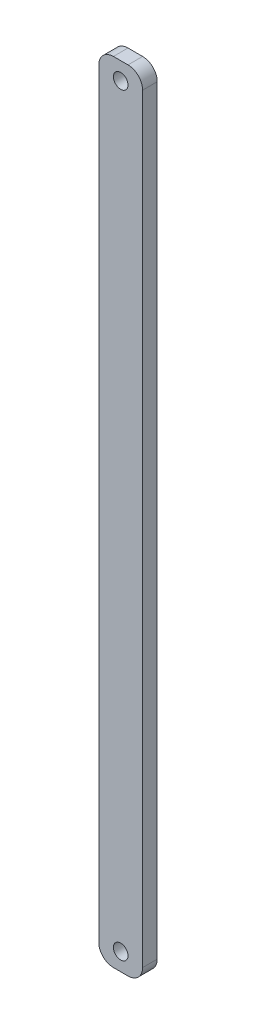
from build123d import *

# Parameters (mm, degrees)
SKETCH1_R           = 0.5
BOSS_EXTRUDE1_DEPTH = 1


with BuildPart() as part:
    # Sketch1 → Boss-Extrude1 (new body)
    with BuildSketch(Plane.XY):
        with BuildLine():
            Line((1, 27), (2, 27))
            ThreePointArc((2, 27), (2.707106781, 26.707106781), (3, 26))
            Line((3, 26), (3, -26))
            ThreePointArc((3, -26), (2.707106781, -26.707106781), (2, -27))
            Line((2, -27), (1.5, -27))
            Line((1.5, -27), (1, -27))
            ThreePointArc((1, -27), (0.292893219, -26.707106781), (0, -26))
            Line((0, -26), (0, 26))
            ThreePointArc((0, 26), (0.292893219, 26.707106781), (1, 27))
        make_face()
        with Locations((1.5, 25.8)):
            Circle(SKETCH1_R, mode=Mode.SUBTRACT)
        with Locations((1.5, -25.8)):
            Circle(SKETCH1_R, mode=Mode.SUBTRACT)
    extrude(amount=BOSS_EXTRUDE1_DEPTH)


solid = part.part
